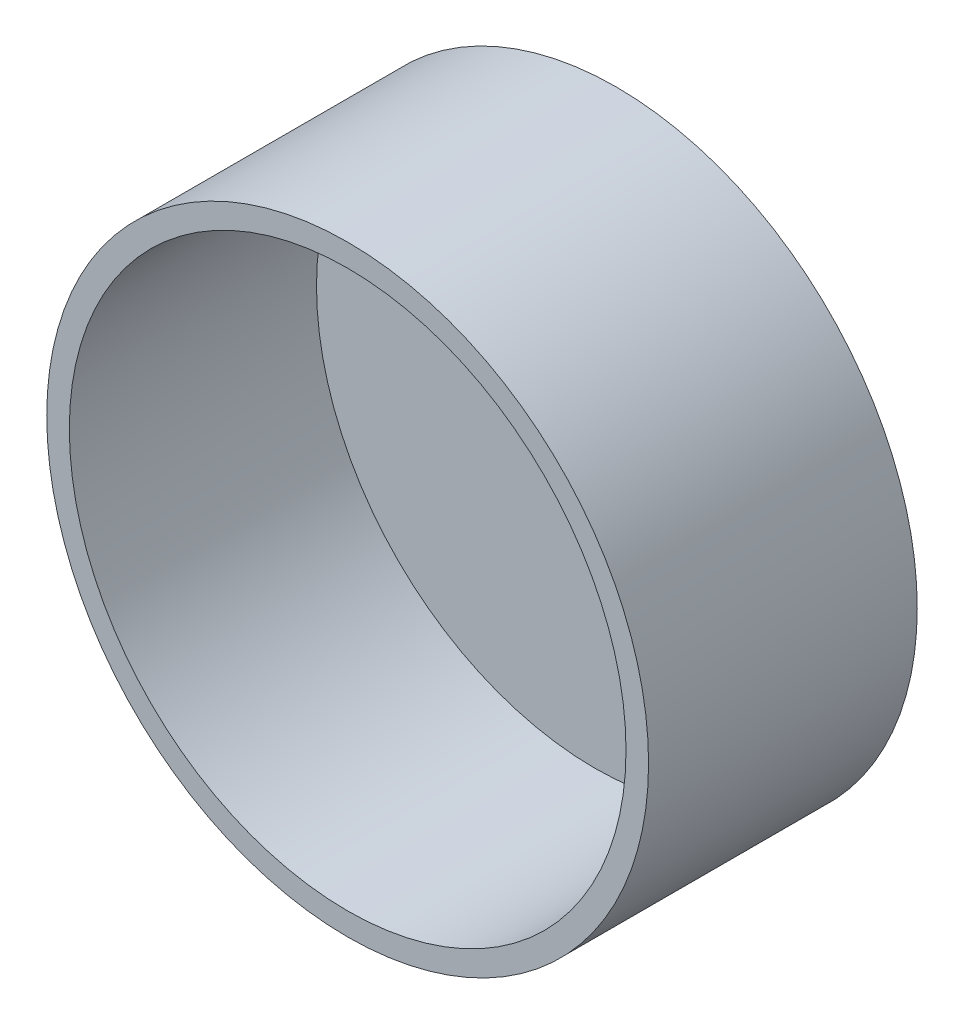
from build123d import *

# Parameters (mm, degrees)
ESQUISSE1_R        = 14
BOSS_EXTRU_1_DEPTH = 1
ESQUISSE2_R        = 14
ESQUISSE2_R_2      = 12.95
BOSS_EXTRU_2_DEPTH = 11.5


with BuildPart() as part:
    # Esquisse1 → Boss.-Extru.1 (new body)
    with BuildSketch(Plane.XY):
        Circle(ESQUISSE1_R)
    extrude(amount=BOSS_EXTRU_1_DEPTH)

    # Esquisse2 → Boss.-Extru.2 (add)
    with BuildSketch(Plane.XY.offset(1)):
        Circle(ESQUISSE2_R)
        Circle(ESQUISSE2_R_2, mode=Mode.SUBTRACT)
    extrude(amount=BOSS_EXTRU_2_DEPTH)


solid = part.part
